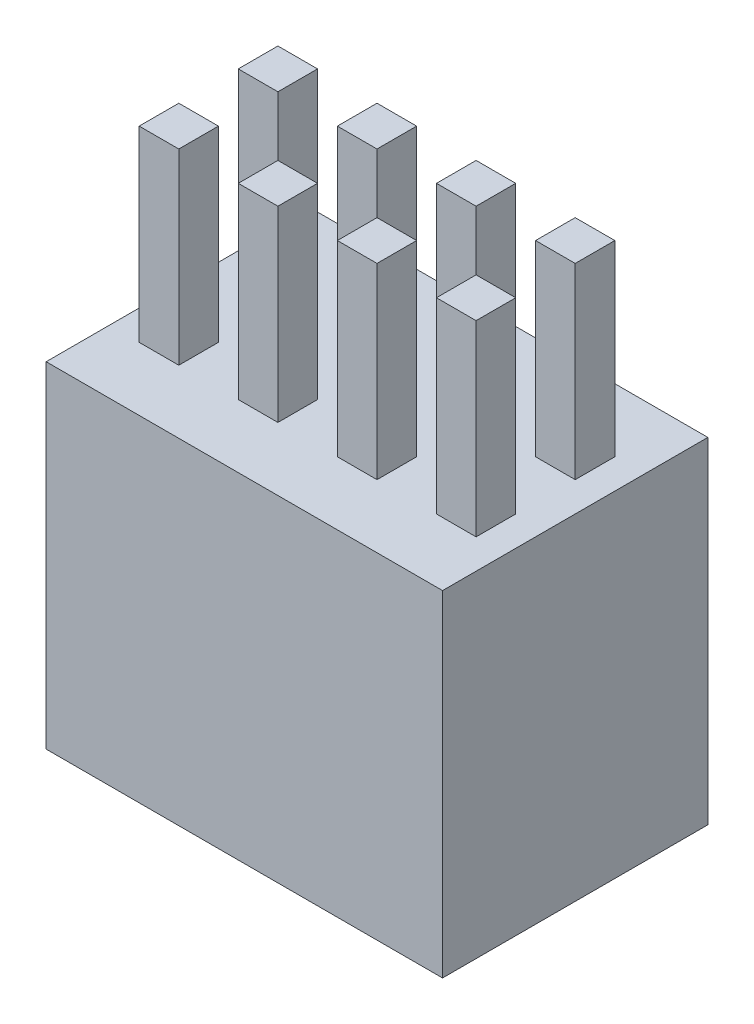
from build123d import *

# Parameters (mm, degrees)
SKETCH1_W           = 5.08
SKETCH1_H           = 3.4
BOSS_EXTRUDE1_DEPTH = 2.15
SKETCH2_W           = 0.508
SKETCH2_H           = 0.508
BOSS_EXTRUDE2_DEPTH = 4.55


with BuildPart() as part:
    # Sketch1 → Boss-Extrude1 (new, symmetric)
    with BuildSketch(Plane(origin=(0, 0, 0), x_dir=(1, 0, 0), z_dir=(0, 1, 0))):
        Rectangle(SKETCH1_W, SKETCH1_H)
    extrude(amount=BOSS_EXTRUDE1_DEPTH, both=True)

    # Sketch2 → Boss-Extrude2 (add)
    with BuildSketch(Plane(origin=(0, 0, 0), x_dir=(1, 0, 0), z_dir=(0, 1, 0))):
        with Locations((-0.635, -0.635)):
            Rectangle(SKETCH2_W, SKETCH2_H)
        with Locations((-1.905, -0.635)):
            Rectangle(SKETCH2_W, SKETCH2_H)
        with Locations((0.635, -0.635)):
            Rectangle(SKETCH2_W, SKETCH2_H)
        with Locations((1.905, -0.635)):
            Rectangle(SKETCH2_W, SKETCH2_H)
        with Locations((-0.635, 0.635)):
            Rectangle(SKETCH2_W, SKETCH2_H)
        with Locations((0.635, 0.635)):
            Rectangle(SKETCH2_W, SKETCH2_H)
        with Locations((1.905, 0.635)):
            Rectangle(SKETCH2_W, SKETCH2_H)
        with Locations((-1.905, 0.635)):
            Rectangle(SKETCH2_W, SKETCH2_H)
    extrude(amount=BOSS_EXTRUDE2_DEPTH)


solid = part.part
